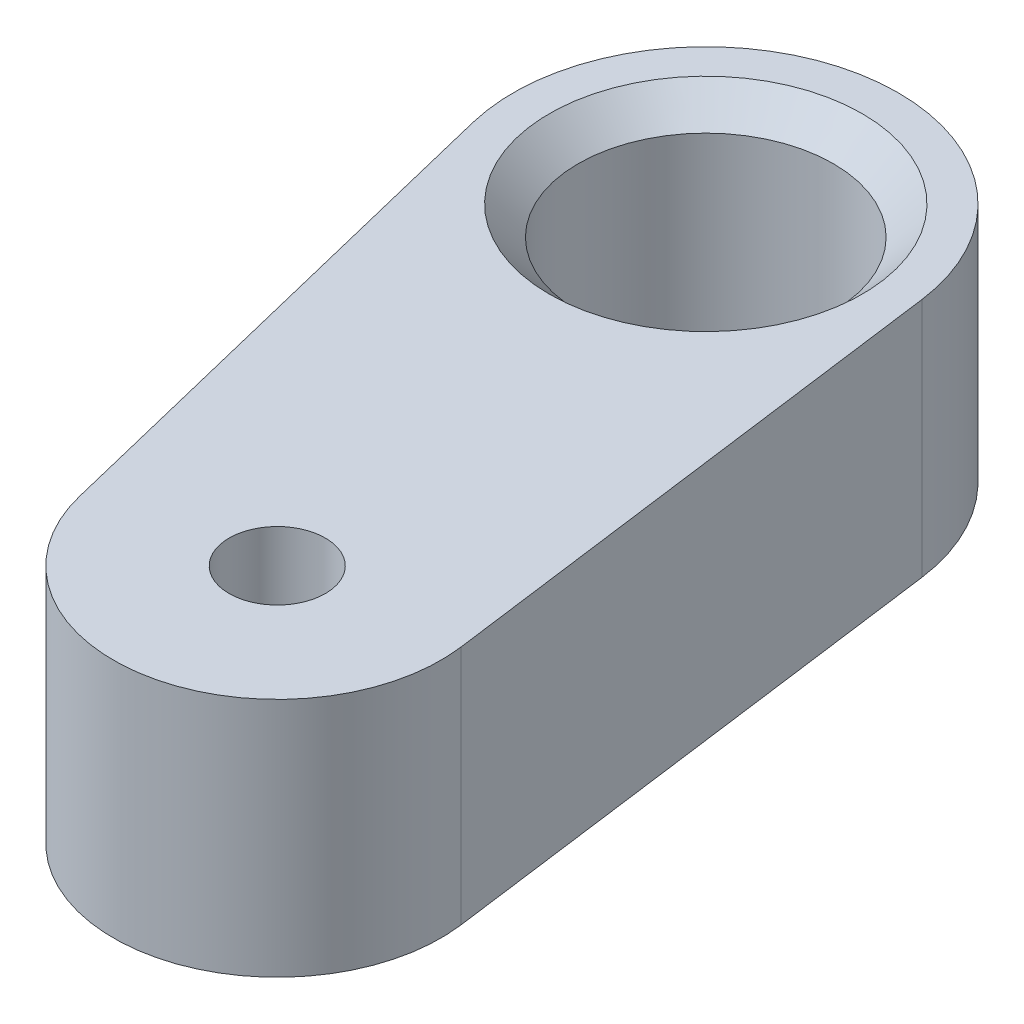
from build123d import *

# Parameters (mm, degrees)
SKETCH1_R           = 2.6
SKETCH1_R_2         = 2.65
BOSS_EXTRUDE1_DEPTH = 3.2
BOSS_EXTRUDE2_START = 3.2
SKETCH1_3_R         = 2.65
SKETCH1_3_R_2       = 1
BOSS_EXTRUDE2_DEPTH = 1.8
CHAMFER1_SIZE       = 0.6
FILLET3_R           = 0.4


with BuildPart() as part:
    # Sketch1 → Boss-Extrude1 (new body)
    with BuildSketch(Plane(origin=(0, 33, 0), x_dir=(1, 0, 0), z_dir=(0, 1, 0))):
        with BuildLine():
            Line((5.429968705, -10.516152569), (3.965267434, 0.525979253))
            ThreePointArc((3.965267434, 0.525979253), (-0.738499825, 3.931236194), (-3.885823258, -0.948882295))
            Line((-3.885823258, -0.948882295), (-1.243458383, -11.769784885))
            ThreePointArc((-1.243458383, -11.769784885), (2.687216237, -14.304785699), (5.429968705, -10.516152569))
        make_face()
        with Locations(Location((2.059491386, -10.963234935, 0), (0, 0, 270))):
            Circle(SKETCH1_R, mode=Mode.SUBTRACT)
        with Locations(Location((0, 0, 0), (0, 0, 270))):
            Circle(SKETCH1_R_2, mode=Mode.SUBTRACT)
    extrude(amount=BOSS_EXTRUDE1_DEPTH)

    # Sketch1<3> → Boss-Extrude2 (add)
    with BuildSketch(Plane(origin=(0, 33, 0), x_dir=(1, 0, 0), z_dir=(0, 1, 0)).offset(BOSS_EXTRUDE2_START)):
        with BuildLine():
            Line((5.429968705, -10.516152569), (3.965267434, 0.525979253))
            ThreePointArc((3.965267434, 0.525979253), (-0.738499825, 3.931236194), (-3.885823258, -0.948882295))
            Line((-3.885823258, -0.948882295), (-1.243458383, -11.769784885))
            ThreePointArc((-1.243458383, -11.769784885), (2.687216237, -14.304785699), (5.429968705, -10.516152569))
        make_face()
        with Locations(Location((0, 0, 0), (0, 0, 270))):
            Circle(SKETCH1_3_R, mode=Mode.SUBTRACT)
        with Locations(Location((2.059491386, -10.963234935, 0), (0, 0, 270))):
            Circle(SKETCH1_3_R_2, mode=Mode.SUBTRACT)
    extrude(amount=BOSS_EXTRUDE2_DEPTH)

    # Chamfer1
    chamfer1_edges = [part.edges().sort_by_distance(p)[0] for p in [
        (0, 33, -2.65),
        (0, 38, -2.65),
    ]]
    chamfer(chamfer1_edges, length=CHAMFER1_SIZE)

    # Fillet3
    fillet3_edges = [part.edges().sort_by_distance(p)[0] for p in [
        (2.059491386, 33, 8.363234935),
    ]]
    fillet(fillet3_edges, radius=FILLET3_R)


solid = part.part
